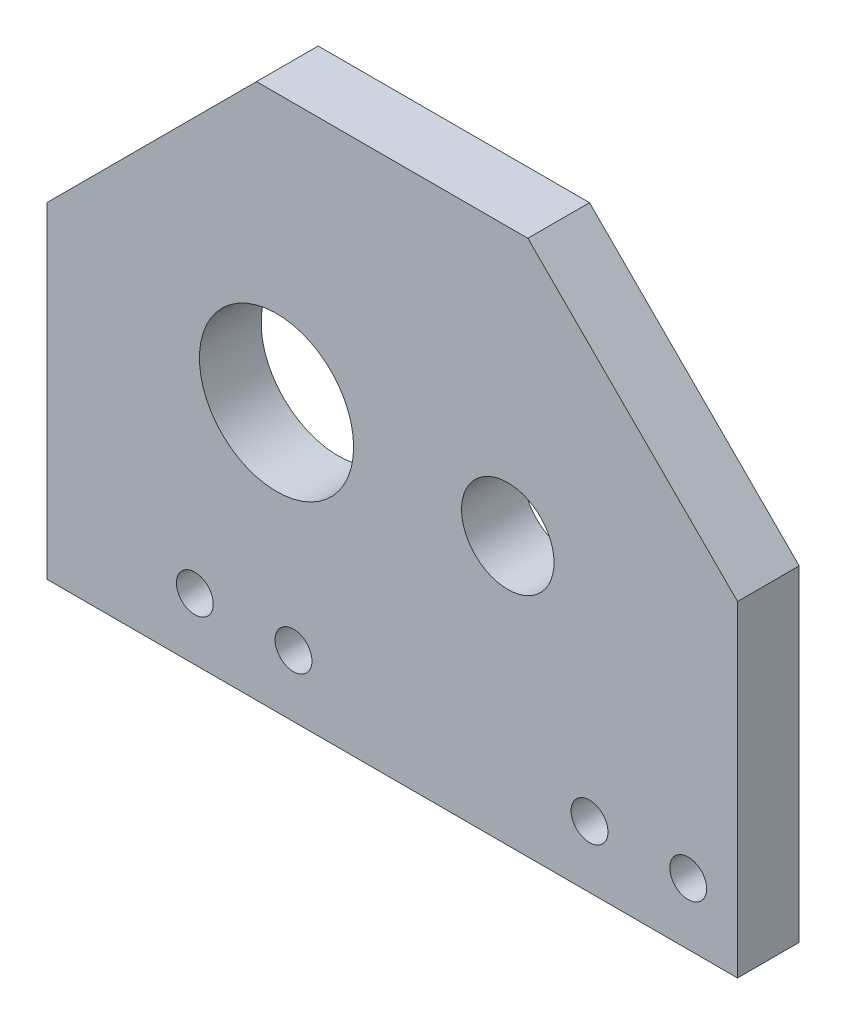
from build123d import *

# Parameters (mm, degrees)
SKETCH1_W             = 71.12
SKETCH1_H             = 55.16372
SKETCH1_R             = 4.7625
SKETCH1_R_2           = 7.9375
BOSS_EXTRUDE1_DEPTH   = 6.35
F_6_CLEARANCE_HOLE1_D = 3.7973
CUT_EXTRUDE1_DEPTH    = 46.448818478


with BuildPart() as part:
    # Sketch1 → Boss-Extrude1 (new body)
    with BuildSketch(Plane.XY):
        Rectangle(SKETCH1_W, SKETCH1_H)
        with Locations((11.90625, 0)):
            Circle(SKETCH1_R, mode=Mode.SUBTRACT)
        with Locations((-11.90625, 0)):
            Circle(SKETCH1_R_2, mode=Mode.SUBTRACT)
    extrude(amount=BOSS_EXTRUDE1_DEPTH)

    # #6 Clearance Hole1 (through all)
    with Locations(Plane.XY.offset(6.35)):
        with Locations((-20.32, -21.23186), (-10.16, -21.23186), (20.32, -21.23186), (30.48, -21.23186)):
            Hole(F_6_CLEARANCE_HOLE1_D / 2)

    # Sketch4 → Cut-Extrude1 (cut, through all)
    with BuildSketch(Plane.XY.offset(6.35)):
        Polygon((-35.56, 5.99186), (-35.56, 27.58186), (-13.97, 27.58186), align=None)
        Polygon((13.97, 27.58186), (35.56, 27.58186), (35.56, 5.99186), align=None)
    extrude(amount=-CUT_EXTRUDE1_DEPTH, mode=Mode.SUBTRACT)


solid = part.part
